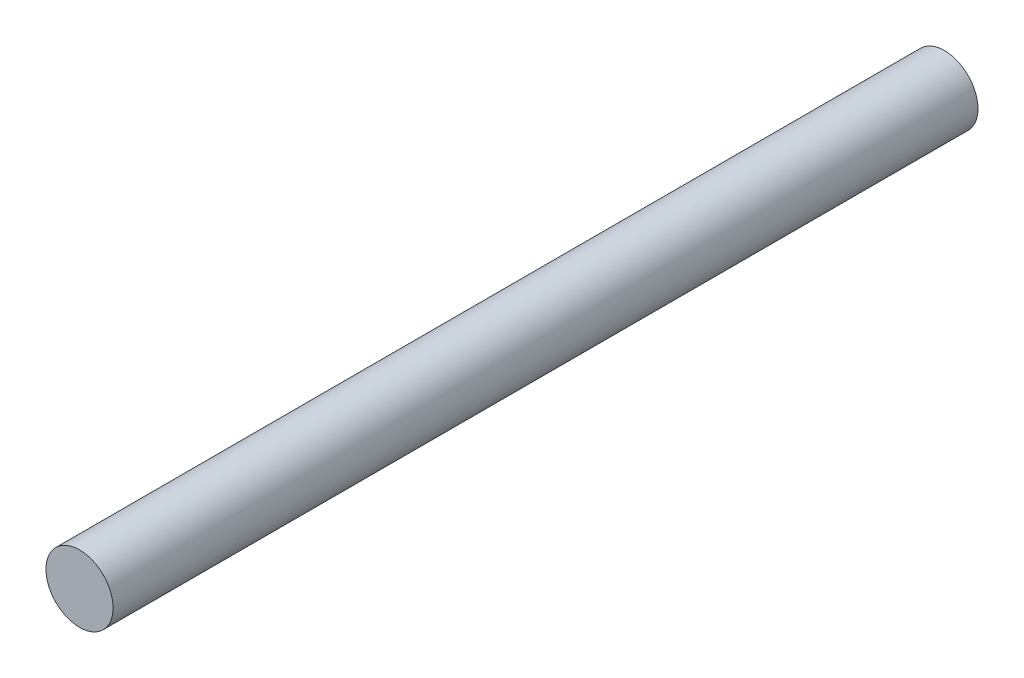
from build123d import *

# Parameters (mm, degrees)
SKETCH1_R           = 4
BOSS_EXTRUDE1_DEPTH = 103


with BuildPart() as part:
    # Sketch1 → Boss-Extrude1 (new body)
    with BuildSketch(Plane.XY):
        Circle(SKETCH1_R)
    extrude(amount=BOSS_EXTRUDE1_DEPTH)


solid = part.part
